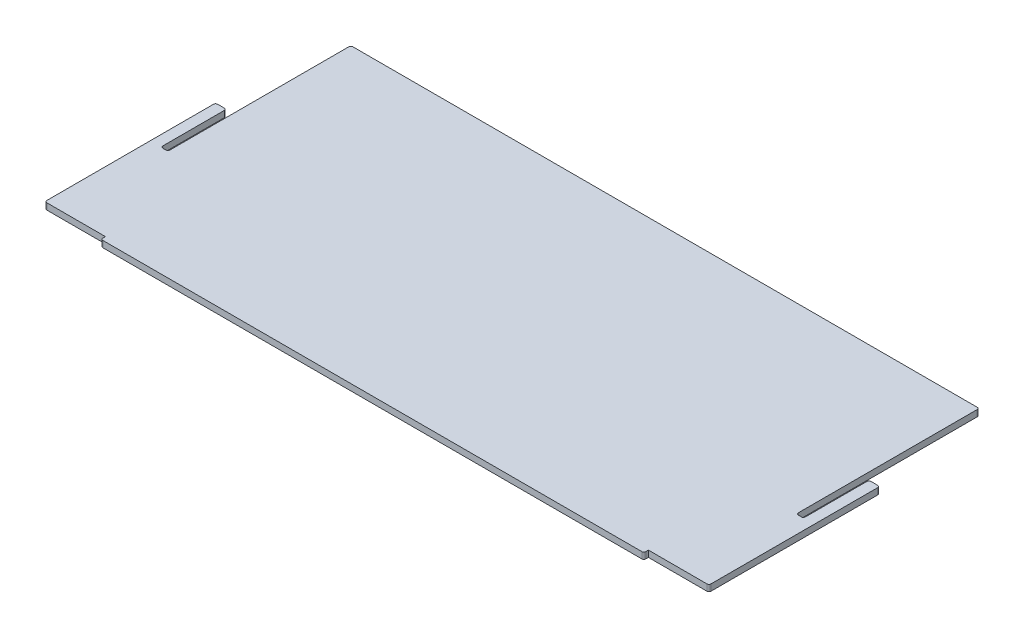
from build123d import *

# Parameters (mm, degrees)
BOSS_EXTRUDE1_DEPTH = 3.175
BOSS_EXTRUDE2_DEPTH = 3.175
FILLET1_R           = 1


with BuildPart() as part:
    # Sketch1 → Boss-Extrude1 (new body)
    with BuildSketch(Plane(origin=(0, 0, 0), x_dir=(1, 0, 0), z_dir=(0, 1, 0))):
        Polygon((292.07333, 0), (313.36742, 0), (313.36742, 143.6878), (0, 143.6878), (0, 0), (21.29409, 0), (21.29409, -2.286), (292.07333, -2.286), align=None)
    extrude(amount=BOSS_EXTRUDE1_DEPTH)

    # Sketch2 → Boss-Extrude2 (add, through all)
    with BuildSketch(Plane(origin=(0, 3.175, 0), x_dir=(1, 0, 0), z_dir=(0, 1, 0))):
        Polygon((0, 0), (-8.926719258, 0), (-8.926719258, 85.152975238), (-3.556, 85.152975238), (-3.556, 52.479835837), (0, 52.479835837), align=None)
        Polygon((313.36742, 52.479835837), (316.92342, 52.479835837), (316.92342, 85.152975238), (322.294139258, 85.152975238), (322.294139258, 0), (313.36742, 0), align=None)
    extrude(amount=-BOSS_EXTRUDE2_DEPTH)

    # Fillet1
    fillet1_edges = [part.edges().sort_by_distance(p)[0] for p in [
        (0, 1.5875, -143.6878),
        (313.36742, 1.5875, -143.6878),
        (292.07333, 1.5875, 2.286),
        (21.29409, 1.5875, 2.286),
        (0, 1.5875, -52.479835837),
        (-8.926719258, 1.5875, 0),
        (-8.926719258, 1.5875, -85.152975238),
        (-3.556, 1.5875, -85.152975238),
        (-3.556, 1.5875, -52.479835837),
        (313.36742, 1.5875, -52.479835837),
        (316.92342, 1.5875, -52.479835837),
        (316.92342, 1.5875, -85.152975238),
        (322.294139258, 1.5875, -85.152975238),
        (322.294139258, 1.5875, 0),
    ]]
    fillet(fillet1_edges, radius=FILLET1_R)


solid = part.part
